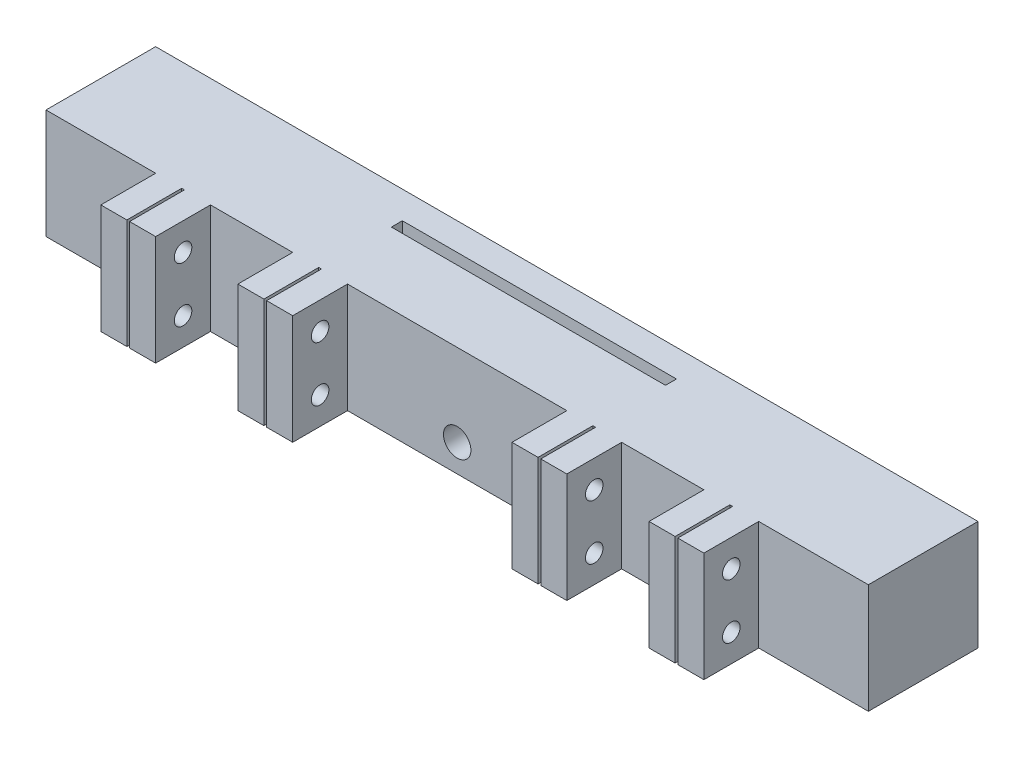
from build123d import *

# Parameters (mm, degrees)
BOSS_EXTRUDE1_DEPTH     = 20
CUT_EXTRUDE1_DEPTH      = 84.216584885
CUT_EXTRUDE1_DEPTH_BACK = 84.216584885
SKETCH2_W               = 0.5
SKETCH2_H               = 10
CUT_EXTRUDE2_DEPTH      = 135.907375632
CUT_EXTRUDE2_DEPTH_BACK = 135.907375632
SKETCH3_R               = 1.6
CUT_EXTRUDE3_DEPTH      = 84.216584885
CUT_EXTRUDE3_DEPTH_BACK = 84.216584885
SKETCH4_W               = 50
SKETCH4_H               = 2
SKETCH5_R               = 2.5
CUT_EXTRUDE4_DEPTH      = 10


with BuildPart() as part:
    # Sketch1 → Boss-Extrude1 (new body)
    with BuildSketch(Plane(origin=(0, 0, 0), x_dir=(1, 0, 0), z_dir=(0, 1, 0))):
        Polygon((0, 0), (-75, 0), (-75, -20), (-55, -20), (-55, -30), (-45, -30), (-45, -20), (-30, -20), (-30, -30), (-20, -30), (-20, -20), (20, -20), (20, -30), (30, -30), (30, -20), (45, -20), (45, -30), (55, -30), (55, -20), (75, -20), (75, 0), align=None)
    extrude(amount=BOSS_EXTRUDE1_DEPTH)

    # Sketch2 → Cut-Extrude1 (cut, two sides: drawn at the far end of the back side and taken through both)
    with BuildSketch(Plane(origin=(0, 20, 0), x_dir=(1, 0, 0), z_dir=(0, 1, 0)).offset(-CUT_EXTRUDE1_DEPTH_BACK)):
        with Locations((-50, -25)):
            Rectangle(SKETCH2_W, SKETCH2_H)
        with Locations((-25, -25)):
            Rectangle(SKETCH2_W, SKETCH2_H)
        with Locations((25, -25)):
            Rectangle(SKETCH2_W, SKETCH2_H)
        with Locations((50, -25)):
            Rectangle(SKETCH2_W, SKETCH2_H)
    extrude(amount=CUT_EXTRUDE1_DEPTH + CUT_EXTRUDE1_DEPTH_BACK, mode=Mode.SUBTRACT)

    # Sketch3 → Cut-Extrude2 (cut, two sides: drawn at the far end of the back side and taken through both)
    with BuildSketch(Plane.ZY.offset(55).offset(-CUT_EXTRUDE2_DEPTH_BACK)):
        with Locations((25, 15)):
            Circle(SKETCH3_R)
        with Locations((25, 5)):
            Circle(SKETCH3_R)
    extrude(amount=CUT_EXTRUDE2_DEPTH + CUT_EXTRUDE2_DEPTH_BACK, mode=Mode.SUBTRACT)

    # Sketch4 → Cut-Extrude3 (cut, two sides: drawn at the far end of the back side and taken through both)
    with BuildSketch(Plane(origin=(0, 20, 0), x_dir=(1, 0, 0), z_dir=(0, 1, 0)).offset(-CUT_EXTRUDE3_DEPTH_BACK)):
        with Locations((0, -6)):
            Rectangle(SKETCH4_W, SKETCH4_H)
    extrude(amount=CUT_EXTRUDE3_DEPTH + CUT_EXTRUDE3_DEPTH_BACK, mode=Mode.SUBTRACT)

    # Sketch5 → Cut-Extrude4 (cut)
    with BuildSketch(Plane.XY.offset(20)):
        with Locations((0, 5)):
            Circle(SKETCH5_R)
    extrude(amount=-CUT_EXTRUDE4_DEPTH, mode=Mode.SUBTRACT)


solid = part.part
